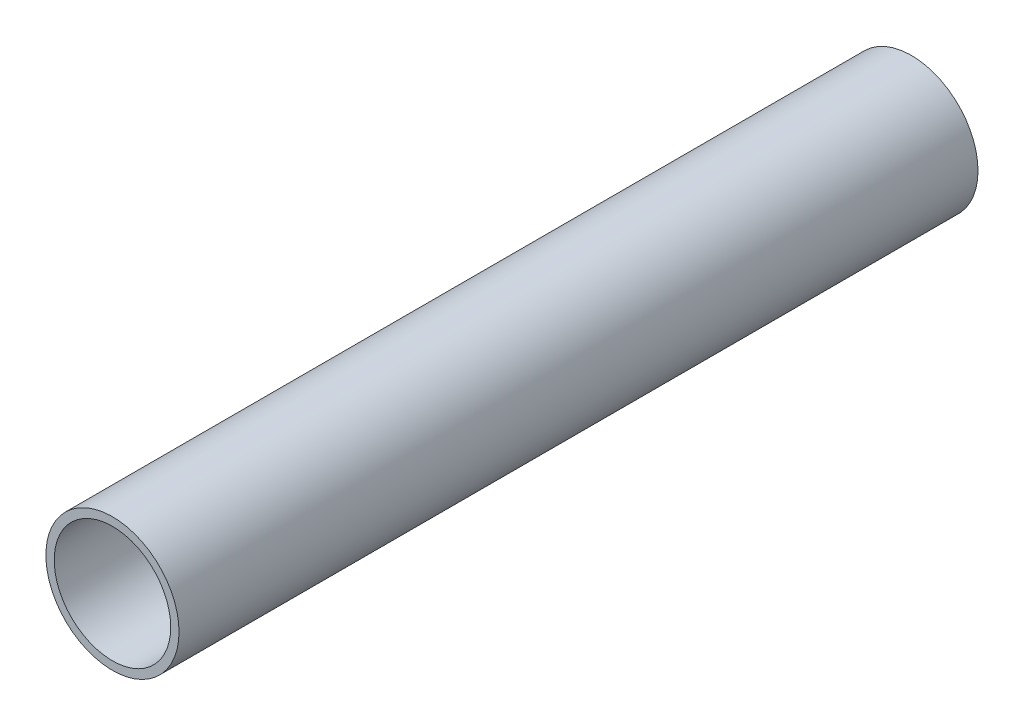
from build123d import *

# Parameters (mm, degrees)
BOSS_EXTRUDE2_DEPTH      = 152.4
BOSS_EXTRUDE2_DEPTH_BACK = 152.4
SKETCH3_R                = 25.4
SKETCH3_R_2              = 22.225


with BuildPart() as part:
    # Sketch3 → Boss-Extrude2 (new, two sides: drawn at the far end of the back side and taken through both)
    with BuildSketch(Plane.XY.offset(-BOSS_EXTRUDE2_DEPTH_BACK)):
        Circle(SKETCH3_R)
        Circle(SKETCH3_R_2, mode=Mode.SUBTRACT)
    extrude(amount=BOSS_EXTRUDE2_DEPTH + BOSS_EXTRUDE2_DEPTH_BACK)


solid = part.part
